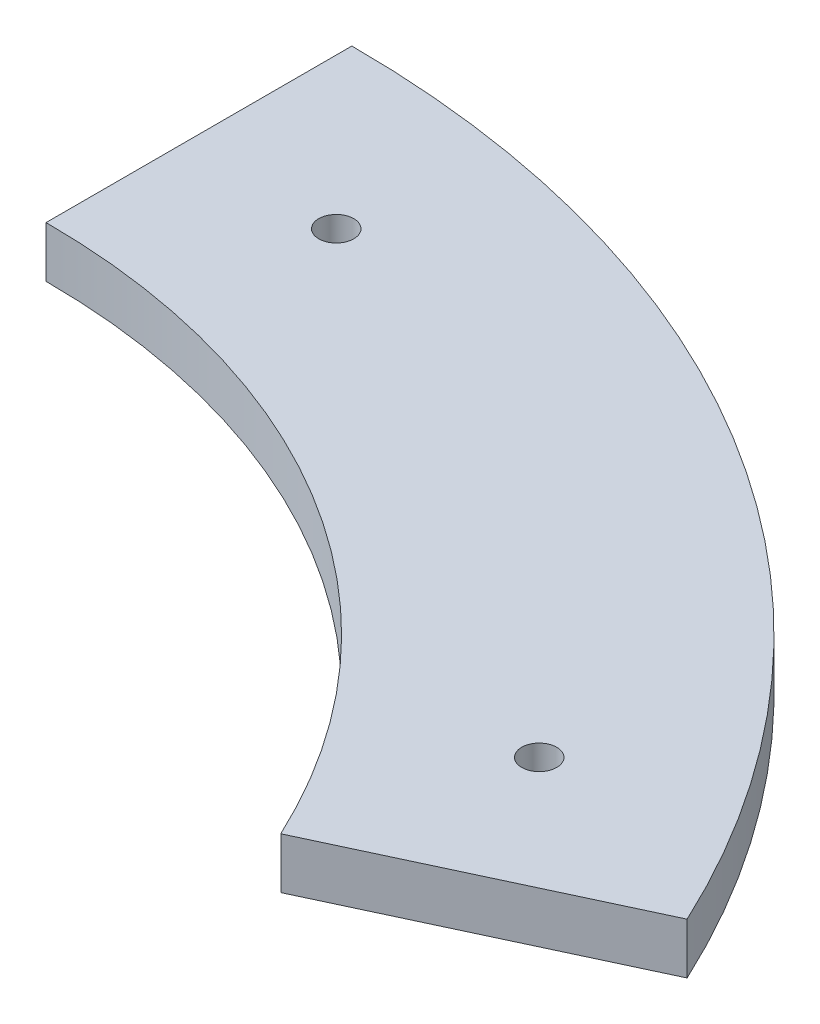
from build123d import *

# Parameters (mm, degrees)
BOSS_EXTRUDE1_DEPTH              = 12.7
F_11_32_0_34375_DIAMETER_HOLE1_D = 8.73125


with BuildPart() as part:
    # Sketch1 → Boss-Extrude1 (new body)
    with BuildSketch(Plane(origin=(0, 0, 0), x_dir=(1, 0, 0), z_dir=(0, 1, 0))):
        with BuildLine():
            Line((0, 177.8), (0, 254))
            ThreePointArc((0, 254), (136.47410052, 214.221427236), (230.202177907, 107.345038482))
            Line((230.202177907, 107.345038482), (161.141524535, 75.141526937))
            ThreePointArc((161.141524535, 75.141526937), (95.531870364, 149.954999066), (0, 177.8))
        make_face()
    extrude(amount=BOSS_EXTRUDE1_DEPTH)

    # 11/32 (0.34375) Diameter Hole1 (through all)
    with Locations(Plane(origin=(0, 12.7, 0), x_dir=(1, 0, 0), z_dir=(0, 1, 0))):
        with Locations((37.490641558, 212.619993875), (176.854926362, 123.835152608)):
            Hole(F_11_32_0_34375_DIAMETER_HOLE1_D / 2)


solid = part.part
